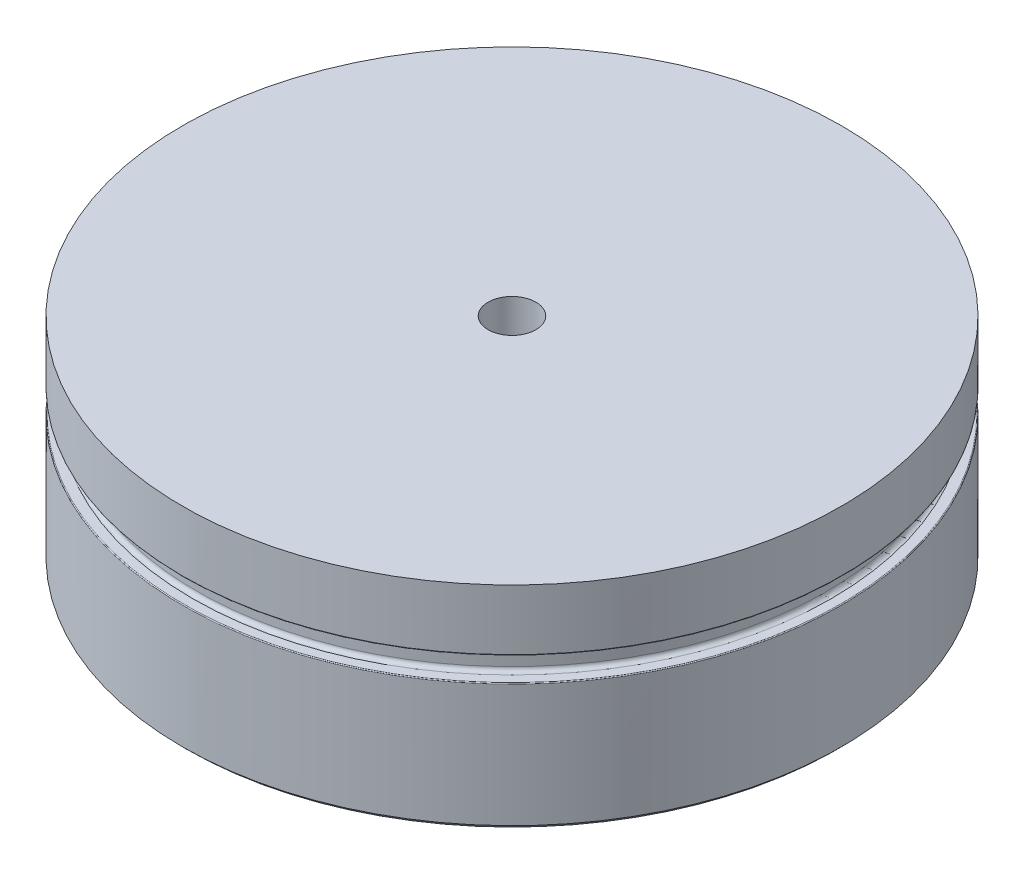
from build123d import *

# Parameters (mm, degrees)
FILLET1_R     = 1.27
FILLET2_R     = 0.254
CHAMFER1_SIZE = 1.27


with BuildPart() as part:
    # Sketch1 → Revolve1 (revolve)
    with BuildSketch(Plane.XY, mode=Mode.PRIVATE) as revolve1_sk:
        Polygon((0, 0), (0, 63.5), (-98.3869, 63.5), (-98.3869, 45.2374), (-94.107, 45.2374), (-94.107, 38.1), (-98.3869, 38.1), (-98.3869, 6.551201717), (-98.3869, 0), align=None)
    revolve(revolve1_sk.sketch.rotate(Axis((0, 0, 0), (0, 1, 0)), 270), axis=Axis((0, 0, 0), (0, 1, 0)))

    # Fillet1
    fillet1_edges = [part.edges().sort_by_distance(p)[0] for p in [
        (0, 38.1, 94.107),
        (0, 45.2374, 94.107),
    ]]
    fillet(fillet1_edges, radius=FILLET1_R)

    # Fillet2
    fillet2_edges = [part.edges().sort_by_distance(p)[0] for p in [
        (0, 38.1, 98.3869),
        (0, 45.2374, 98.3869),
    ]]
    fillet(fillet2_edges, radius=FILLET2_R)

    # Chamfer1
    chamfer1_edges = [part.edges().sort_by_distance(p)[0] for p in [
        (0, 0, 98.3869),
    ]]
    chamfer(chamfer1_edges, length=CHAMFER1_SIZE)

    # Sketch7 → 3/8 NPT Tapped Hole3 (revolve, cut)
    with BuildSketch(Plane(origin=(0, 0, 0), x_dir=(0, 0, -1), z_dir=(1, 0, 0))):
        Polygon((0, 0), (0, 63.5), (7.1374, 63.5), (7.1374, 10.3378), (8.250003024, 10.3378), (8.5727413, 0), align=None)
    revolve(axis=Axis((0, -6.35, 0), (0, 1, 0)), mode=Mode.SUBTRACT)


solid = part.part
